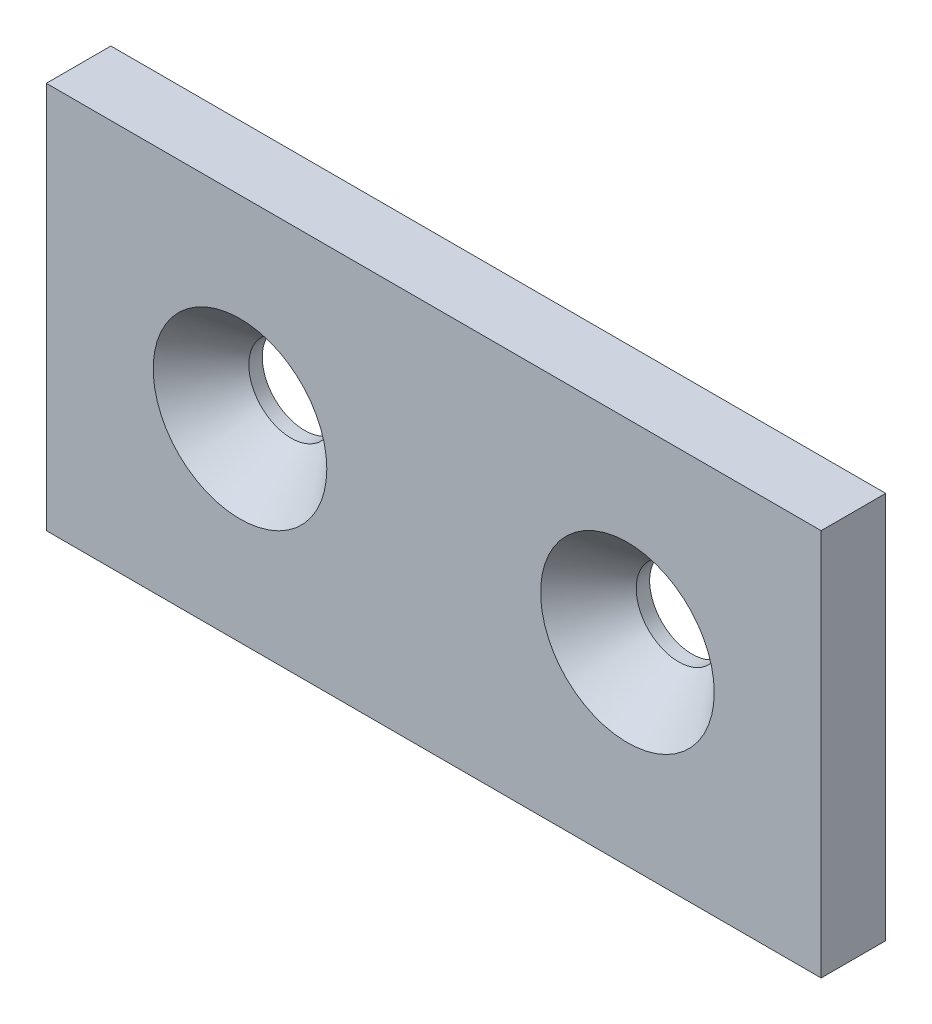
from build123d import *

# Parameters (mm, degrees)
SKETCH1_W                    = 76.2
SKETCH1_H                    = 38.1
SKETCH1_R                    = 4.1656
BOSS_EXTRUDE1_DEPTH          = 3.175
CUT_EXTRUDE1_START           = -5.0292
SKETCH2_R                    = 4.1656
CUT_EXTRUDE1_DEPTH           = 91.459712699
CUT_EXTRUDE1_DRAFT           = -41
CUT_EXTRUDE1_PROFILE_2_DEPTH = 91.459712699
CUT_EXTRUDE1_PROFILE_2_DRAFT = -41


with BuildPart() as part:
    # Sketch1 → Boss-Extrude1 (new, symmetric)
    with BuildSketch(Plane.XY):
        with Locations((38.1, 19.05)):
            Rectangle(SKETCH1_W, SKETCH1_H)
        with Locations((19.05, 19.05)):
            Circle(SKETCH1_R, mode=Mode.SUBTRACT)
        with Locations((57.15, 19.05)):
            Circle(SKETCH1_R, mode=Mode.SUBTRACT)
    extrude(amount=BOSS_EXTRUDE1_DEPTH, both=True)


with BuildPart() as cut_extrude1_tool:
    # Sketch2 → Cut-Extrude1 (with draft: the straight prism first)
    with BuildSketch(Plane.XY.offset(3.175).offset(CUT_EXTRUDE1_START)):
        with Locations((19.05, 19.05)):
            Circle(SKETCH2_R)
    extrude(amount=CUT_EXTRUDE1_DEPTH)
    # Cut-Extrude1: the draft: its side faces are tilted about the plane it starts from
    cut_extrude1_sides = [cut_extrude1_tool.faces().sort_by_distance(p)[0] for p in [
        (14.8844, 19.05, 43.875656349),
    ]]
    draft(cut_extrude1_sides, Plane.XY.offset(3.175).offset(CUT_EXTRUDE1_START), CUT_EXTRUDE1_DRAFT)


with BuildPart() as part_1:
    add(part.part)

    # Cut-Extrude1: cut by cut_extrude1_tool
    add(cut_extrude1_tool.part, mode=Mode.SUBTRACT)


with BuildPart() as cut_extrude1_profile_2_tool:
    # Sketch2 → Cut-Extrude1 profile 2 (with draft: the straight prism first)
    with BuildSketch(Plane.XY.offset(3.175).offset(CUT_EXTRUDE1_START)):
        with Locations((57.15, 19.05)):
            Circle(SKETCH2_R)
    extrude(amount=CUT_EXTRUDE1_PROFILE_2_DEPTH)
    # Cut-Extrude1 profile 2: the draft: its side faces are tilted about the plane it starts from
    cut_extrude1_profile_2_sides = [cut_extrude1_profile_2_tool.faces().sort_by_distance(p)[0] for p in [
        (52.9844, 19.05, 43.875656349),
    ]]
    draft(cut_extrude1_profile_2_sides, Plane.XY.offset(3.175).offset(CUT_EXTRUDE1_START), CUT_EXTRUDE1_PROFILE_2_DRAFT)


with BuildPart() as part_2:
    add(part_1.part)

    # Cut-Extrude1 profile 2: cut by cut_extrude1_profile_2_tool
    add(cut_extrude1_profile_2_tool.part, mode=Mode.SUBTRACT)


solid = part_2.part
